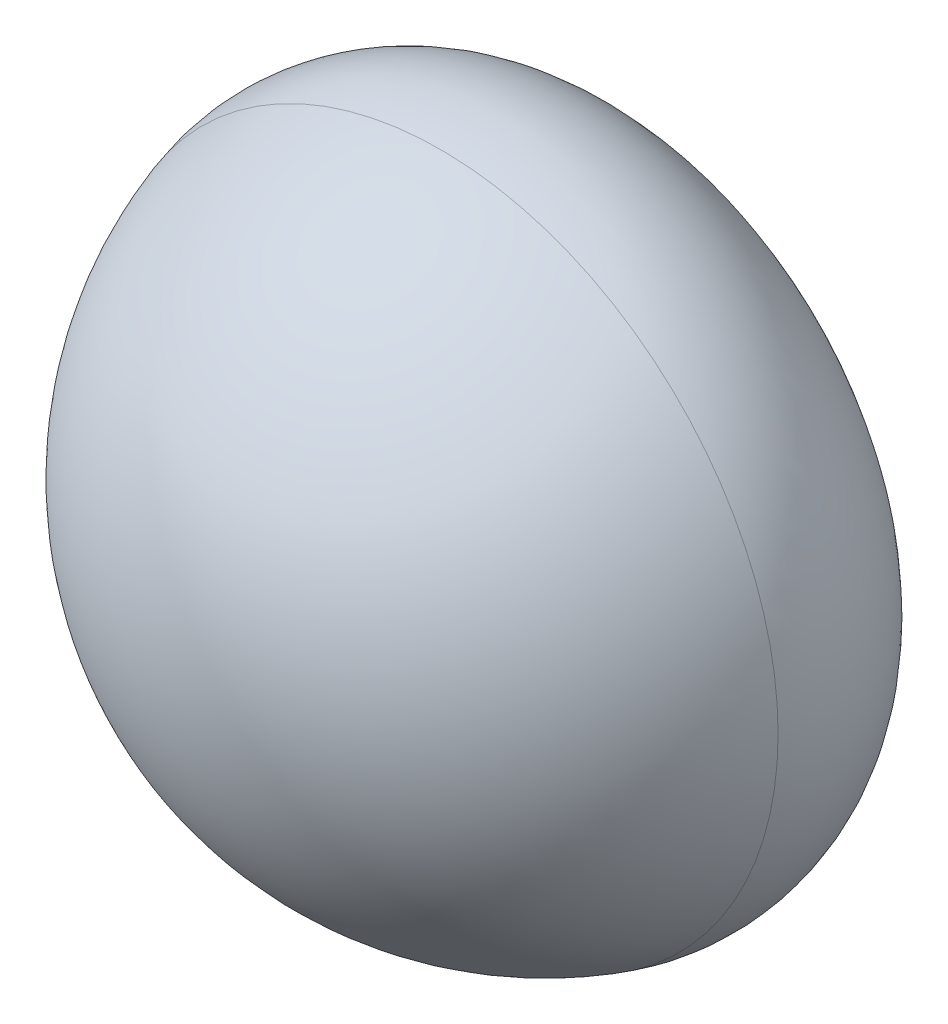
from build123d import *


with BuildPart() as part:
    # 草图2 → 旋转2 (revolve)
    with BuildSketch(Plane(origin=(0, 0, 0), x_dir=(1, 0, 0), z_dir=(0, 1, 0))):
        with BuildLine():
            Line((0, -78.868874327), (0, -86.268874327))
            ThreePointArc((0, -86.268874327), (3.010260964, -85.280906698), (4.849639886, -82.701287292))
            ThreePointArc((4.849639886, -82.701287292), (4.819735764, -81.212484825), (3.90104125, -80.040551623))
            ThreePointArc((3.90104125, -80.040551623), (2.036599526, -79.168117557), (0, -78.868874327))
        make_face()
    revolve(axis=Axis((0, 0, 0), (0, 0, -1)))


solid = part.part
